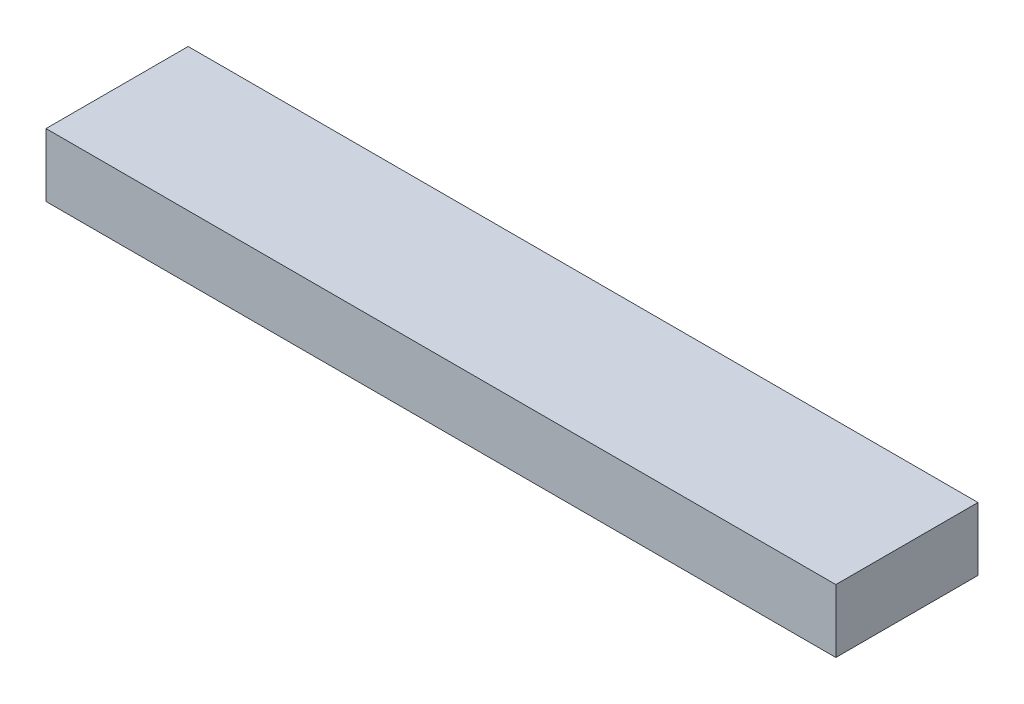
from build123d import *

# Parameters (mm, degrees)
SKETCH1_W           = 250
SKETCH1_H           = 45
BOSS_EXTRUDE1_DEPTH = 10


with BuildPart() as part:
    # Sketch1 → Boss-Extrude1 (new, symmetric)
    with BuildSketch(Plane(origin=(0, 0, 0), x_dir=(1, 0, 0), z_dir=(0, 1, 0))):
        Rectangle(SKETCH1_W, SKETCH1_H)
    extrude(amount=BOSS_EXTRUDE1_DEPTH, both=True)


solid = part.part
